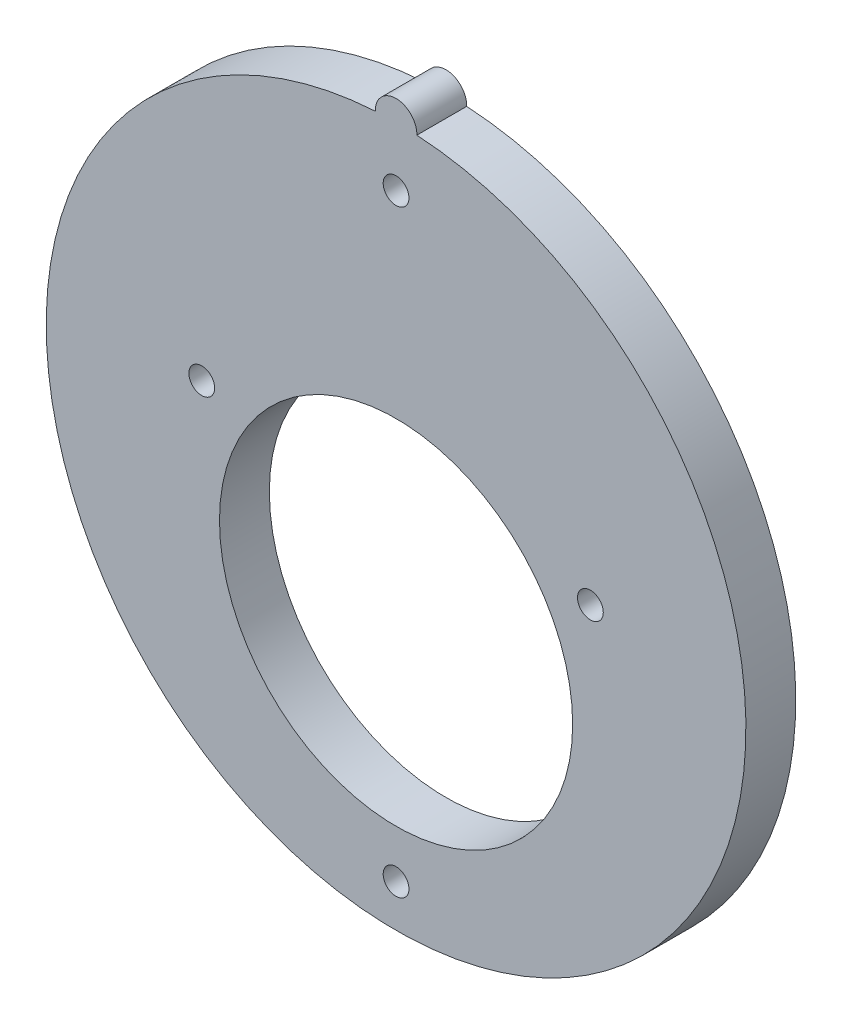
from build123d import *

# Parameters (mm, degrees)
DODANIE_WYCI_GNI_CIE1_DEPTH = 6
SZKIC3_R                    = 21.25
WYTNIJ_WYCI_GNI_CIE1_DEPTH  = 10
SZKIC4_R                    = 1.55
WYTNIJ_WYCI_GNI_CIE2_DEPTH  = 10


with BuildPart() as part:
    # Szkic1 → Dodanie-wyciągnięcie1 (new body)
    with BuildSketch(Plane.XY):
        with BuildLine():
            ThreePointArc((38.780616011, 73.907751151), (41.279513808, -10.21802082), (43.778411605, 73.907751151))
            ThreePointArc((43.778411605, 73.907751151), (41.279513808, 76.48197918), (38.780616011, 73.907751151))
        make_face()
    extrude(amount=DODANIE_WYCI_GNI_CIE1_DEPTH)

    # Szkic3 → Wytnij-wyciągnięcie1 (cut)
    with BuildSketch(Plane.XY.offset(6)):
        with Locations((41.279513808, 21.88197918)):
            Circle(SZKIC3_R)
    extrude(amount=-WYTNIJ_WYCI_GNI_CIE1_DEPTH, mode=Mode.SUBTRACT)

    # Szkic4 → Wytnij-wyciągnięcie2 (cut)
    with BuildSketch(Plane.XY.offset(6)):
        with Locations((41.279513808, -5.11802082)):
            Circle(SZKIC4_R)
        with Locations((17.896827906, 35.38197918)):
            Circle(SZKIC4_R)
        with Locations((64.66219971, 35.38197918)):
            Circle(SZKIC4_R)
        with Locations((41.279513808, 66.88197918)):
            Circle(SZKIC4_R)
    extrude(amount=-WYTNIJ_WYCI_GNI_CIE2_DEPTH, mode=Mode.SUBTRACT)


solid = part.part
